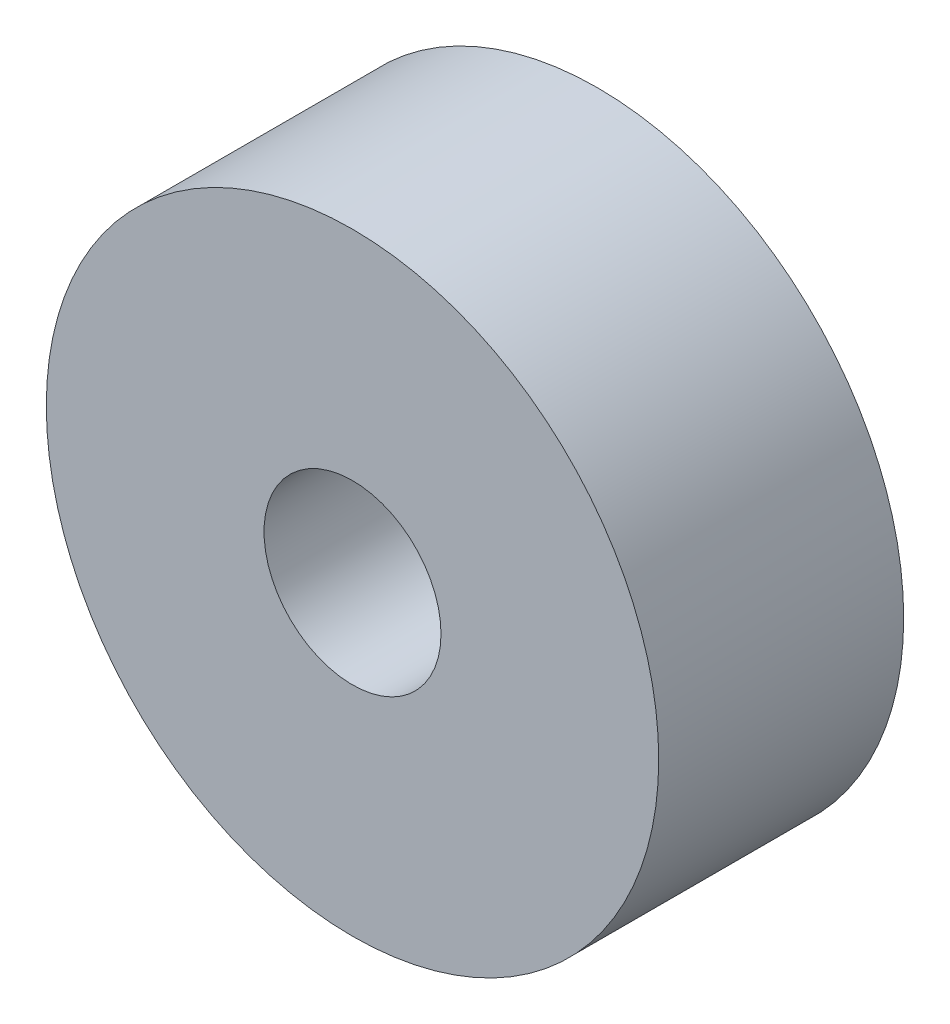
from build123d import *

# Parameters (mm, degrees)
SKETCH1_R           = 5
SKETCH1_R_2         = 1.445
BOSS_EXTRUDE2_DEPTH = 4


with BuildPart() as part:
    # Sketch1 → Boss-Extrude2 (new body)
    with BuildSketch(Plane.XY):
        with Locations((-4.077535724, 1.249567399)):
            Circle(SKETCH1_R)
        with Locations((-4.077535724, 1.249567399)):
            Circle(SKETCH1_R_2, mode=Mode.SUBTRACT)
    extrude(amount=BOSS_EXTRUDE2_DEPTH)


solid = part.part
